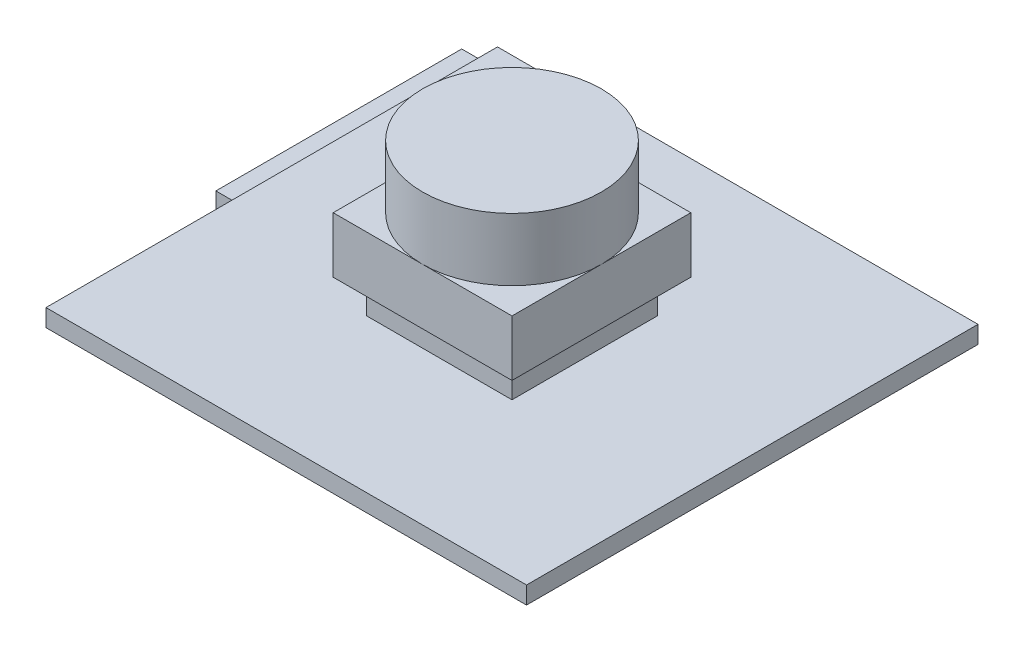
from build123d import *

# Parameters (mm, degrees)
SKETCH_1_W      = 21.5
SKETCH_1_H      = 20.2
EXTRUDE_1_DEPTH = 0.78
SKETCH_2_W      = 6.5
SKETCH_2_H      = 6.5
EXTRUDE_2_DEPTH = 1.5
SKETCH_3_W      = 8
SKETCH_3_H      = 8
EXTRUDE_3_DEPTH = 2.5
SKETCH_4_R      = 4
EXTRUDE_4_DEPTH = 2.8
SKETCH_5_W      = 15.5
SKETCH_5_H      = 11
EXTRUDE_5_DEPTH = 2.28


with BuildPart() as part:
    # Эскиз1 → Бобышка-Вытянуть1 (new body)
    with BuildSketch(Plane(origin=(0, 0, 0), x_dir=(1, 0, 0), z_dir=(0, 1, 0))):
        Rectangle(SKETCH_1_W, SKETCH_1_H)
    extrude(amount=EXTRUDE_1_DEPTH)

    # Эскиз2 → Бобышка-Вытянуть2 (add)
    with BuildSketch(Plane(origin=(0, 0.78, 0), x_dir=(1, 0, 0), z_dir=(0, 1, 0))):
        Rectangle(SKETCH_2_W, SKETCH_2_H)
    extrude(amount=EXTRUDE_2_DEPTH)

    # Эскиз3 → Бобышка-Вытянуть3 (add)
    with BuildSketch(Plane(origin=(0, 2.28, 0), x_dir=(1, 0, 0), z_dir=(0, 1, 0))):
        Rectangle(SKETCH_3_W, SKETCH_3_H)
    extrude(amount=EXTRUDE_3_DEPTH)

    # Эскиз4 → Бобышка-Вытянуть4 (add)
    with BuildSketch(Plane(origin=(0, 4.78, 0), x_dir=(1, 0, 0), z_dir=(0, 1, 0))):
        with Locations(Location((0, 0, 0), (0, 0, 270))):
            Circle(SKETCH_4_R)
    extrude(amount=EXTRUDE_4_DEPTH)

    # Эскиз5 → Бобышка-Вытянуть5 (add)
    with BuildSketch(Plane.XZ):
        with Locations((-4.5, -4.5)):
            Rectangle(SKETCH_5_W, SKETCH_5_H)
    extrude(amount=EXTRUDE_5_DEPTH)


solid = part.part
